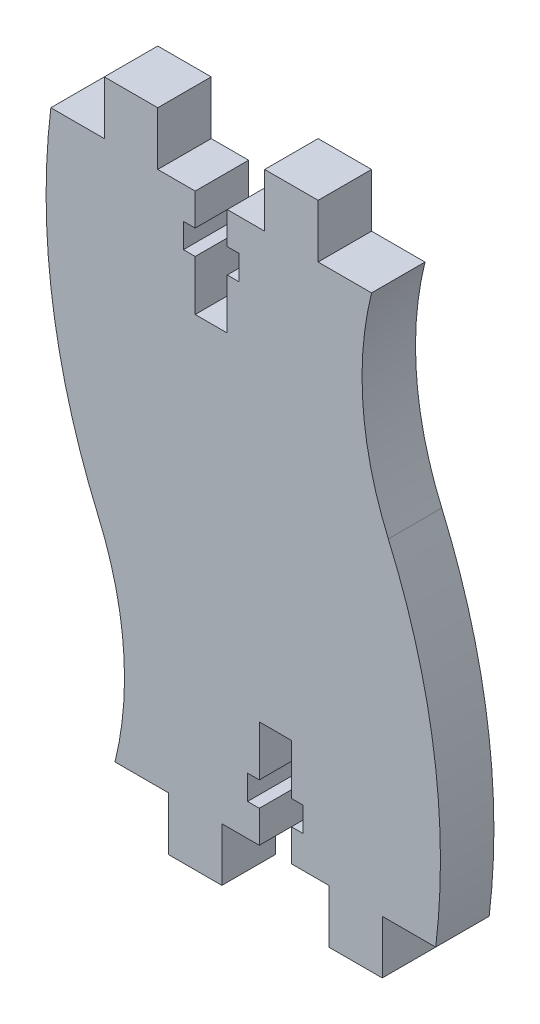
from build123d import *

# Parameters (mm, degrees)
BOSS_EXTRUDE1_DEPTH = 5


with BuildPart() as part:
    # Sketch1 → Boss-Extrude1 (new body)
    with BuildSketch(Plane.XY):
        with BuildLine():
            Line((14, 50), (19, 50))
            ThreePointArc((19, 50), (18.209779748, 40.299429042), (20.566557713, 30.856382787))
            ThreePointArc((20.566557713, 30.856382787), (24.838069928, 15.723423589), (25, 0))
            Line((25, 0), (20, 0))
            Line((20, 0), (20, -5))
            Line((20, -5), (15, -5))
            Line((15, -5), (15, 0))
            Line((15, 0), (11.5, 0))
            Line((11.5, 0), (11.5, 3))
            Line((11.5, 3), (12.6, 3))
            Line((12.6, 3), (12.6, 5.3))
            Line((12.6, 5.3), (11.5, 5.3))
            Line((11.5, 5.3), (11.5, 10))
            Line((11.5, 10), (8.5, 10))
            Line((8.5, 10), (8.5, 5.3))
            Line((8.5, 5.3), (7.4, 5.3))
            Line((7.4, 5.3), (7.4, 3))
            Line((7.4, 3), (8.5, 3))
            Line((8.5, 3), (8.5, 0))
            Line((8.5, 0), (5, 0))
            Line((5, 0), (5, -5))
            Line((5, -5), (0, -5))
            Line((0, -5), (0, 0))
            Line((0, 0), (-5, 0))
            ThreePointArc((-5, 0), (-4.209779748, 9.700570958), (-6.566557713, 19.143617213))
            ThreePointArc((-6.566557713, 19.143617213), (-10.838069928, 34.276576411), (-11, 50))
            Line((-11, 50), (-6, 50))
            Line((-6, 50), (-6, 55))
            Line((-6, 55), (-1, 55))
            Line((-1, 55), (-1, 50))
            Line((-1, 50), (2.5, 50))
            Line((2.5, 50), (2.5, 47))
            Line((2.5, 47), (1.4, 47))
            Line((1.4, 47), (1.4, 44.7))
            Line((1.4, 44.7), (2.5, 44.7))
            Line((2.5, 44.7), (2.5, 40))
            Line((2.5, 40), (5.5, 40))
            Line((5.5, 40), (5.5, 44.7))
            Line((5.5, 44.7), (6.6, 44.7))
            Line((6.6, 44.7), (6.6, 47))
            Line((6.6, 47), (5.5, 47))
            Line((5.5, 47), (5.5, 50))
            Line((5.5, 50), (9, 50))
            Line((9, 50), (9, 55))
            Line((9, 55), (14, 55))
            Line((14, 55), (14, 50))
        make_face()
    extrude(amount=BOSS_EXTRUDE1_DEPTH)


solid = part.part
